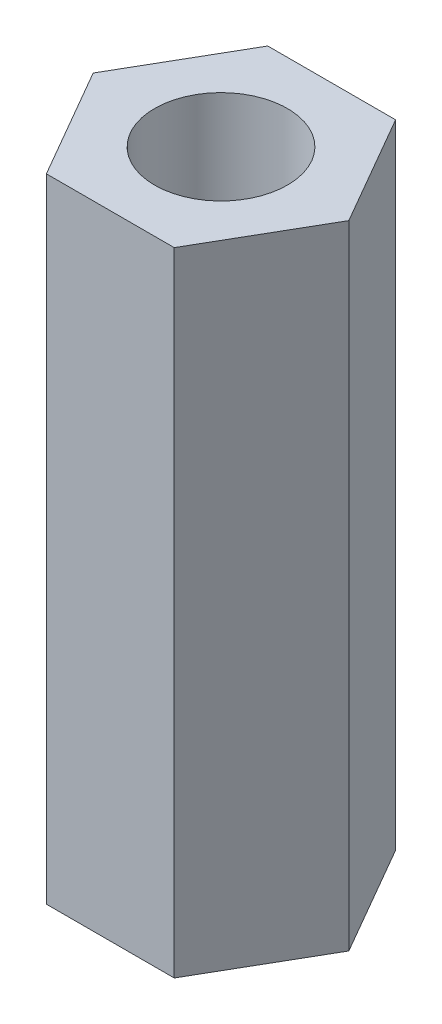
from build123d import *

# Parameters (mm, degrees)
SKETCH1_R           = 2.1
BOSS_EXTRUDE1_DEPTH = 20


with BuildPart() as part:
    # Sketch1 → Boss-Extrude1 (new body)
    with BuildSketch(Plane(origin=(0, 0, 0), x_dir=(1, 0, 0), z_dir=(0, 1, 0))):
        Polygon((4.041451884, 0), (2.020725942, 3.5), (-2.020725942, 3.5), (-4.041451884, 0), (-2.020725942, -3.5), (2.020725942, -3.5), align=None)
        with Locations(Location((0, 0, 0), (0, 0, 270))):
            Circle(SKETCH1_R, mode=Mode.SUBTRACT)
    extrude(amount=BOSS_EXTRUDE1_DEPTH)


solid = part.part
